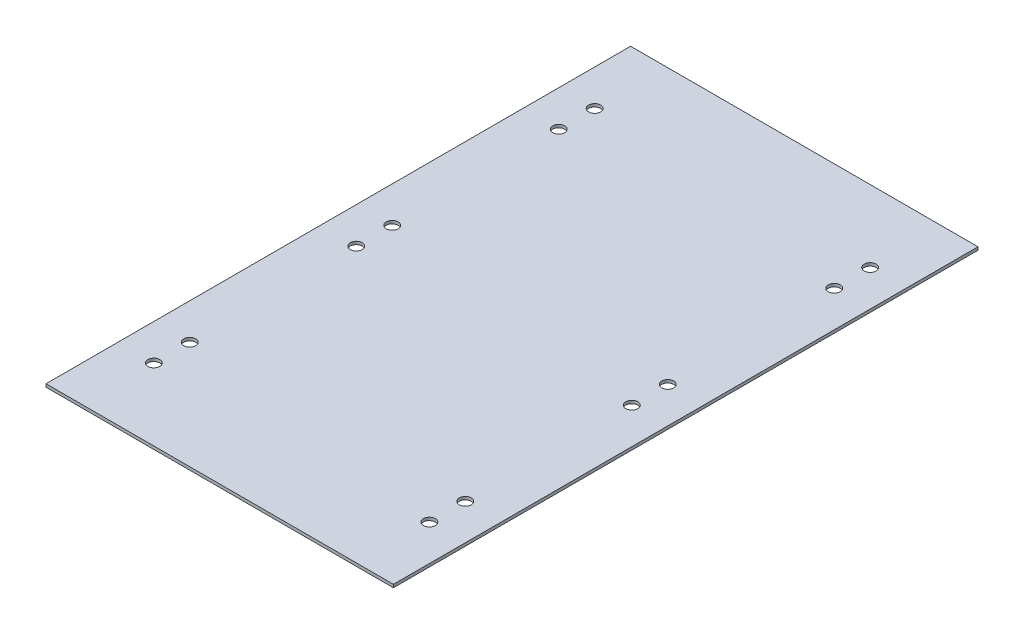
from build123d import *

# Parameters (mm, degrees)
SKETCH1_W           = 184.15
SKETCH1_H           = 309.88
BOSS_EXTRUDE1_DEPTH = 1.5875
SKETCH2_R           = 3.175
CUT_EXTRUDE1_DEPTH  = 181.240753941


with BuildPart() as part:
    # Sketch1 → Boss-Extrude1 (new body)
    with BuildSketch(Plane(origin=(0, 0, 0), x_dir=(1, 0, 0), z_dir=(0, 1, 0))):
        Rectangle(SKETCH1_W, SKETCH1_H)
    extrude(amount=BOSS_EXTRUDE1_DEPTH)

    # Sketch2 → Cut-Extrude1 (cut, through all)
    with BuildSketch(Plane(origin=(0, 1.5875, 0), x_dir=(1, 0, 0), z_dir=(0, 1, 0))):
        with Locations(Location((-73.025, 9.525, 0), (0, 0, 270))):
            Circle(SKETCH2_R)
        with Locations(Location((-73.025, -9.525, 0), (0, 0, 270))):
            Circle(SKETCH2_R)
        with Locations(Location((-73.025, 116.84, 0), (0, 0, 270))):
            Circle(SKETCH2_R)
        with Locations(Location((-73.025, 97.79, 0), (0, 0, 270))):
            Circle(SKETCH2_R)
        with Locations(Location((-73.025, -116.84, 0), (0, 0, 270))):
            Circle(SKETCH2_R)
        with Locations(Location((-73.025, -97.79, 0), (0, 0, 270))):
            Circle(SKETCH2_R)
    cut_extrude1 = extrude(amount=-CUT_EXTRUDE1_DEPTH, mode=Mode.SUBTRACT)

    # Mirror1: Cut-Extrude1 across plane
    add(cut_extrude1.mirror(Plane(origin=(0, 0, 0), x_dir=(0, 0, 1), z_dir=(1, 0, 0))), mode=Mode.SUBTRACT)


solid = part.part
